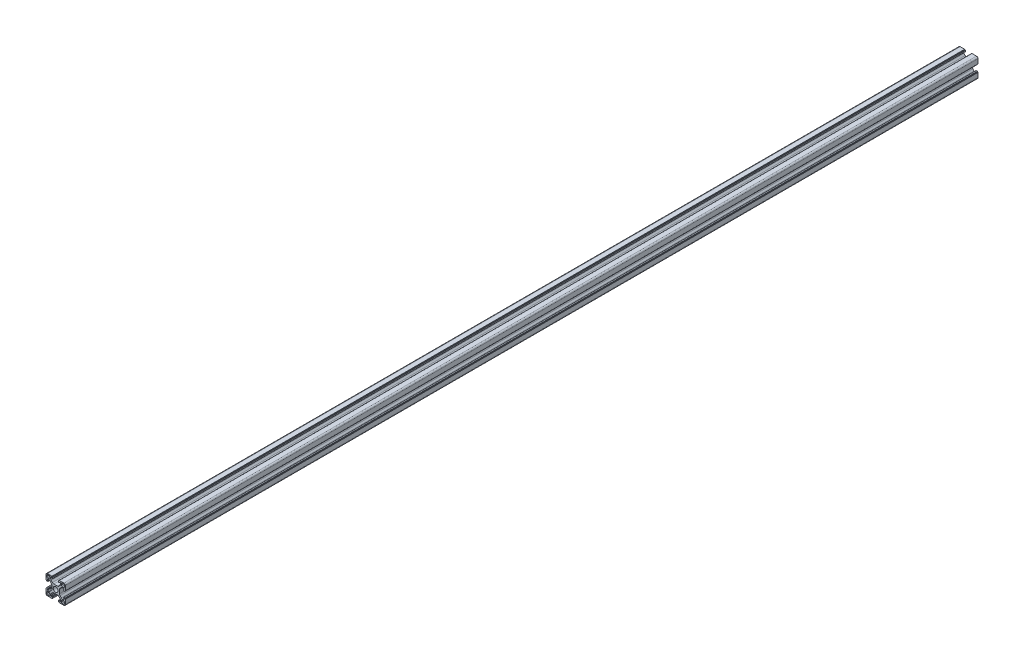
from build123d import *

# Parameters (mm, degrees)
EXTRUDE_1_DEPTH = 945


with BuildPart() as part:
    # Эскиз2 → Бобышка-Вытянуть1 (new body)
    with BuildSketch(Plane.XY):
        with BuildLine():
            Line((0.129852449, 4.683728486), (2.028633118, 4.683728486))
            ThreePointArc((2.028633118, 4.683728486), (2.793999983, 4.835969421), (3.44284668, 5.269514923))
            Line((3.44284668, 5.269514923), (4.744066011, 6.570734254))
            ThreePointArc((4.744066011, 6.570734254), (5.177611514, 7.219580952), (5.329852449, 7.984947817))
            Line((5.329852449, 7.984947817), (5.329852449, 8.883728486))
            ThreePointArc((5.329852449, 8.883728486), (5.183405839, 9.237281876), (4.829852449, 9.383728486))
            Line((4.829852449, 9.383728486), (4.72695923, 9.383728486))
            ThreePointArc((4.72695923, 9.383728486), (4.535617514, 9.345668252), (4.373405839, 9.237281876))
            Line((4.373405839, 9.237281876), (3.893075754, 8.75695179))
            ThreePointArc((3.893075754, 8.75695179), (3.811969916, 8.702758603), (3.716299058, 8.683728486))
            Line((3.716299058, 8.683728486), (3.429852449, 8.683728486))
            ThreePointArc((3.429852449, 8.683728486), (3.253075754, 8.75695179), (3.179852449, 8.933728486))
            Line((3.179852449, 8.933728486), (3.179852449, 10.082799306))
            ThreePointArc((3.179852449, 10.082799306), (3.223786432, 10.188865323), (3.329852449, 10.232799306))
            Line((3.329852449, 10.232799306), (3.829852449, 10.232799306))
            Line((3.829852449, 10.232799306), (3.829852449, 10.533728486))
            ThreePointArc((3.829852449, 10.533728486), (3.873786432, 10.639794503), (3.979852449, 10.683728486))
            Line((3.979852449, 10.683728486), (8.629852449, 10.683728486))
            ThreePointArc((8.629852449, 10.683728486), (9.690512621, 10.244388658), (10.129852449, 9.183728486))
            Line((10.129852449, 9.183728486), (10.129852449, 4.533728486))
            ThreePointArc((10.129852449, 4.533728486), (10.085918466, 4.427662469), (9.979852449, 4.383728486))
            Line((9.979852449, 4.383728486), (9.678923269, 4.383728486))
            Line((9.678923269, 4.383728486), (9.678923269, 3.883728486))
            ThreePointArc((9.678923269, 3.883728486), (9.634989287, 3.777662469), (9.528923269, 3.733728486))
            Line((9.528923269, 3.733728486), (8.379852449, 3.733728486))
            ThreePointArc((8.379852449, 3.733728486), (8.203075754, 3.80695179), (8.129852449, 3.983728486))
            Line((8.129852449, 3.983728486), (8.129852449, 4.270175095))
            ThreePointArc((8.129852449, 4.270175095), (8.148882566, 4.365845953), (8.203075754, 4.44695179))
            Line((8.203075754, 4.44695179), (8.683405839, 4.927281876))
            ThreePointArc((8.683405839, 4.927281876), (8.791792215, 5.089493551), (8.829852449, 5.280835267))
            Line((8.829852449, 5.280835267), (8.829852449, 5.383728486))
            ThreePointArc((8.829852449, 5.383728486), (8.683405839, 5.737281876), (8.329852449, 5.883728486))
            Line((8.329852449, 5.883728486), (7.43107178, 5.883728486))
            ThreePointArc((7.43107178, 5.883728486), (6.665704915, 5.731487551), (6.016858217, 5.297942048))
            Line((6.016858217, 5.297942048), (4.715638886, 3.996722717))
            ThreePointArc((4.715638886, 3.996722717), (4.282093384, 3.34787602), (4.129852449, 2.582509155))
            Line((4.129852449, 2.582509155), (4.129852449, 0.683728486))
            Line((4.129852449, 0.683728486), (4.129852449, -1.215052183))
            ThreePointArc((4.129852449, -1.215052183), (4.282093384, -1.980419048), (4.715638886, -2.629265746))
            Line((4.715638886, -2.629265746), (6.016858217, -3.930485077))
            ThreePointArc((6.016858217, -3.930485077), (6.665704915, -4.364030579), (7.43107178, -4.516271514))
            Line((7.43107178, -4.516271514), (8.329852449, -4.516271514))
            ThreePointArc((8.329852449, -4.516271514), (8.683405839, -4.369824905), (8.829852449, -4.016271514))
            Line((8.829852449, -4.016271514), (8.829852449, -3.913378295))
            ThreePointArc((8.829852449, -3.913378295), (8.791792215, -3.722036579), (8.683405839, -3.559824905))
            Line((8.683405839, -3.559824905), (8.203075754, -3.079494819))
            ThreePointArc((8.203075754, -3.079494819), (8.148882566, -2.998388982), (8.129852449, -2.902718124))
            Line((8.129852449, -2.902718124), (8.129852449, -2.616271514))
            ThreePointArc((8.129852449, -2.616271514), (8.203075754, -2.439494819), (8.379852449, -2.366271514))
            Line((8.379852449, -2.366271514), (9.528923269, -2.366271514))
            ThreePointArc((9.528923269, -2.366271514), (9.634989287, -2.410205497), (9.678923269, -2.516271514))
            Line((9.678923269, -2.516271514), (9.678923269, -3.016271514))
            Line((9.678923269, -3.016271514), (9.979852449, -3.016271514))
            ThreePointArc((9.979852449, -3.016271514), (10.085918466, -3.060205497), (10.129852449, -3.166271514))
            Line((10.129852449, -3.166271514), (10.129852449, -7.816271514))
            ThreePointArc((10.129852449, -7.816271514), (9.690512621, -8.876931686), (8.629852449, -9.316271514))
            Line((8.629852449, -9.316271514), (3.979852449, -9.316271514))
            ThreePointArc((3.979852449, -9.316271514), (3.873786432, -9.272337531), (3.829852449, -9.166271514))
            Line((3.829852449, -9.166271514), (3.829852449, -8.865342335))
            Line((3.829852449, -8.865342335), (3.329852449, -8.865342335))
            ThreePointArc((3.329852449, -8.865342335), (3.223786432, -8.821408352), (3.179852449, -8.715342335))
            Line((3.179852449, -8.715342335), (3.179852449, -7.566271514))
            ThreePointArc((3.179852449, -7.566271514), (3.253075754, -7.389494819), (3.429852449, -7.316271514))
            Line((3.429852449, -7.316271514), (3.716299058, -7.316271514))
            ThreePointArc((3.716299058, -7.316271514), (3.811969916, -7.335301631), (3.893075754, -7.389494819))
            Line((3.893075754, -7.389494819), (4.373405839, -7.869824905))
            ThreePointArc((4.373405839, -7.869824905), (4.535617514, -7.978211281), (4.72695923, -8.016271514))
            Line((4.72695923, -8.016271514), (4.829852449, -8.016271514))
            ThreePointArc((4.829852449, -8.016271514), (5.183405839, -7.869824905), (5.329852449, -7.516271514))
            Line((5.329852449, -7.516271514), (5.329852449, -6.617490845))
            ThreePointArc((5.329852449, -6.617490845), (5.177611514, -5.85212398), (4.744066011, -5.203277283))
            Line((4.744066011, -5.203277283), (3.44284668, -3.902057952))
            ThreePointArc((3.44284668, -3.902057952), (2.793999983, -3.468512449), (2.028633118, -3.316271514))
            Line((2.028633118, -3.316271514), (0.129852449, -3.316271514))
            Line((0.129852449, -3.316271514), (-1.76892822, -3.316271514))
            ThreePointArc((-1.76892822, -3.316271514), (-2.534295085, -3.468512449), (-3.183141783, -3.902057952))
            Line((-3.183141783, -3.902057952), (-4.484361114, -5.203277283))
            ThreePointArc((-4.484361114, -5.203277283), (-4.917906616, -5.85212398), (-5.070147551, -6.617490845))
            Line((-5.070147551, -6.617490845), (-5.070147551, -7.516271514))
            ThreePointArc((-5.070147551, -7.516271514), (-4.923700942, -7.869824905), (-4.570147551, -8.016271514))
            Line((-4.570147551, -8.016271514), (-4.467254332, -8.016271514))
            ThreePointArc((-4.467254332, -8.016271514), (-4.275912616, -7.978211281), (-4.113700942, -7.869824905))
            Line((-4.113700942, -7.869824905), (-3.633370856, -7.389494819))
            ThreePointArc((-3.633370856, -7.389494819), (-3.552265019, -7.335301631), (-3.456594161, -7.316271514))
            Line((-3.456594161, -7.316271514), (-3.170147551, -7.316271514))
            ThreePointArc((-3.170147551, -7.316271514), (-2.993370856, -7.389494819), (-2.920147551, -7.566271514))
            Line((-2.920147551, -7.566271514), (-2.920147551, -8.715342335))
            ThreePointArc((-2.920147551, -8.715342335), (-2.964081534, -8.821408352), (-3.070147551, -8.865342335))
            Line((-3.070147551, -8.865342335), (-3.570147551, -8.865342335))
            Line((-3.570147551, -8.865342335), (-3.570147551, -9.166271514))
            ThreePointArc((-3.570147551, -9.166271514), (-3.614081534, -9.272337531), (-3.720147551, -9.316271514))
            Line((-3.720147551, -9.316271514), (-8.370147551, -9.316271514))
            ThreePointArc((-8.370147551, -9.316271514), (-9.430807723, -8.876931686), (-9.870147551, -7.816271514))
            Line((-9.870147551, -7.816271514), (-9.870147551, -3.166271514))
            ThreePointArc((-9.870147551, -3.166271514), (-9.826213568, -3.060205497), (-9.720147551, -3.016271514))
            Line((-9.720147551, -3.016271514), (-9.419218372, -3.016271514))
            Line((-9.419218372, -3.016271514), (-9.419218372, -2.516271514))
            ThreePointArc((-9.419218372, -2.516271514), (-9.375284389, -2.410205497), (-9.269218372, -2.366271514))
            Line((-9.269218372, -2.366271514), (-8.120147551, -2.366271514))
            ThreePointArc((-8.120147551, -2.366271514), (-7.943370856, -2.439494819), (-7.870147551, -2.616271514))
            Line((-7.870147551, -2.616271514), (-7.870147551, -2.902718124))
            ThreePointArc((-7.870147551, -2.902718124), (-7.889177668, -2.998388982), (-7.943370856, -3.079494819))
            Line((-7.943370856, -3.079494819), (-8.423700942, -3.559824905))
            ThreePointArc((-8.423700942, -3.559824905), (-8.532087317, -3.722036579), (-8.570147551, -3.913378295))
            Line((-8.570147551, -3.913378295), (-8.570147551, -4.016271514))
            ThreePointArc((-8.570147551, -4.016271514), (-8.423700942, -4.369824905), (-8.070147551, -4.516271514))
            Line((-8.070147551, -4.516271514), (-7.171366882, -4.516271514))
            ThreePointArc((-7.171366882, -4.516271514), (-6.406000017, -4.364030579), (-5.75715332, -3.930485077))
            Line((-5.75715332, -3.930485077), (-4.455933989, -2.629265746))
            ThreePointArc((-4.455933989, -2.629265746), (-4.022388486, -1.980419048), (-3.870147551, -1.215052183))
            Line((-3.870147551, -1.215052183), (-3.870147551, 0.683728486))
            Line((-3.870147551, 0.683728486), (-3.870147551, 2.582509155))
            ThreePointArc((-3.870147551, 2.582509155), (-4.022388486, 3.34787602), (-4.455933989, 3.996722717))
            Line((-4.455933989, 3.996722717), (-5.75715332, 5.297942048))
            ThreePointArc((-5.75715332, 5.297942048), (-6.406000017, 5.731487551), (-7.171366882, 5.883728486))
            Line((-7.171366882, 5.883728486), (-8.070147551, 5.883728486))
            ThreePointArc((-8.070147551, 5.883728486), (-8.423700942, 5.737281876), (-8.570147551, 5.383728486))
            Line((-8.570147551, 5.383728486), (-8.570147551, 5.280835267))
            ThreePointArc((-8.570147551, 5.280835267), (-8.532087317, 5.089493551), (-8.423700942, 4.927281876))
            Line((-8.423700942, 4.927281876), (-7.943370856, 4.44695179))
            ThreePointArc((-7.943370856, 4.44695179), (-7.889177668, 4.365845953), (-7.870147551, 4.270175095))
            Line((-7.870147551, 4.270175095), (-7.870147551, 3.983728486))
            ThreePointArc((-7.870147551, 3.983728486), (-7.943370856, 3.80695179), (-8.120147551, 3.733728486))
            Line((-8.120147551, 3.733728486), (-9.269218372, 3.733728486))
            ThreePointArc((-9.269218372, 3.733728486), (-9.375284389, 3.777662469), (-9.419218372, 3.883728486))
            Line((-9.419218372, 3.883728486), (-9.419218372, 4.383728486))
            Line((-9.419218372, 4.383728486), (-9.720147551, 4.383728486))
            ThreePointArc((-9.720147551, 4.383728486), (-9.826213568, 4.427662469), (-9.870147551, 4.533728486))
            Line((-9.870147551, 4.533728486), (-9.870147551, 9.183728486))
            ThreePointArc((-9.870147551, 9.183728486), (-9.430807723, 10.244388658), (-8.370147551, 10.683728486))
            Line((-8.370147551, 10.683728486), (-3.720147551, 10.683728486))
            ThreePointArc((-3.720147551, 10.683728486), (-3.614081534, 10.639794503), (-3.570147551, 10.533728486))
            Line((-3.570147551, 10.533728486), (-3.570147551, 10.232799306))
            Line((-3.570147551, 10.232799306), (-3.070147551, 10.232799306))
            ThreePointArc((-3.070147551, 10.232799306), (-2.964081534, 10.188865323), (-2.920147551, 10.082799306))
            Line((-2.920147551, 10.082799306), (-2.920147551, 8.933728486))
            ThreePointArc((-2.920147551, 8.933728486), (-2.993370856, 8.75695179), (-3.170147551, 8.683728486))
            Line((-3.170147551, 8.683728486), (-3.456594161, 8.683728486))
            ThreePointArc((-3.456594161, 8.683728486), (-3.552265019, 8.702758603), (-3.633370856, 8.75695179))
            Line((-3.633370856, 8.75695179), (-4.113700942, 9.237281876))
            ThreePointArc((-4.113700942, 9.237281876), (-4.275912616, 9.345668252), (-4.467254332, 9.383728486))
            Line((-4.467254332, 9.383728486), (-4.570147551, 9.383728486))
            ThreePointArc((-4.570147551, 9.383728486), (-4.923700942, 9.237281876), (-5.070147551, 8.883728486))
            Line((-5.070147551, 8.883728486), (-5.070147551, 7.984947817))
            ThreePointArc((-5.070147551, 7.984947817), (-4.917906616, 7.219580952), (-4.484361114, 6.570734254))
            Line((-4.484361114, 6.570734254), (-3.183141783, 5.269514923))
            ThreePointArc((-3.183141783, 5.269514923), (-2.534295085, 4.835969421), (-1.76892822, 4.683728486))
            Line((-1.76892822, 4.683728486), (0.129852449, 4.683728486))
        make_face()
        with BuildLine():
            Line((7.029852449, 6.783728486), (8.429852449, 6.783728486))
            ThreePointArc((8.429852449, 6.783728486), (8.995537874, 7.018043061), (9.229852449, 7.583728486))
            Line((9.229852449, 7.583728486), (9.229852449, 8.983728486))
            ThreePointArc((9.229852449, 8.983728486), (8.995537874, 9.549413911), (8.429852449, 9.783728486))
            Line((8.429852449, 9.783728486), (7.029852449, 9.783728486))
            ThreePointArc((7.029852449, 9.783728486), (6.464167024, 9.549413911), (6.229852449, 8.983728486))
            Line((6.229852449, 8.983728486), (6.229852449, 7.583728486))
            ThreePointArc((6.229852449, 7.583728486), (6.464167024, 7.018043061), (7.029852449, 6.783728486))
        make_face(mode=Mode.SUBTRACT)
        with BuildLine():
            Line((6.229852449, -6.216271514), (6.229852449, -7.616271514))
            ThreePointArc((6.229852449, -7.616271514), (6.464167024, -8.181956939), (7.029852449, -8.416271514))
            Line((7.029852449, -8.416271514), (8.429852449, -8.416271514))
            ThreePointArc((8.429852449, -8.416271514), (8.995537874, -8.181956939), (9.229852449, -7.616271514))
            Line((9.229852449, -7.616271514), (9.229852449, -6.216271514))
            ThreePointArc((9.229852449, -6.216271514), (8.995537874, -5.650586089), (8.429852449, -5.416271514))
            Line((8.429852449, -5.416271514), (7.029852449, -5.416271514))
            ThreePointArc((7.029852449, -5.416271514), (6.464167024, -5.650586089), (6.229852449, -6.216271514))
        make_face(mode=Mode.SUBTRACT)
        with BuildLine():
            Line((-6.770147551, -5.416271514), (-8.170147551, -5.416271514))
            ThreePointArc((-8.170147551, -5.416271514), (-8.735832976, -5.650586089), (-8.970147551, -6.216271514))
            Line((-8.970147551, -6.216271514), (-8.970147551, -7.616271514))
            ThreePointArc((-8.970147551, -7.616271514), (-8.735832976, -8.181956939), (-8.170147551, -8.416271514))
            Line((-8.170147551, -8.416271514), (-6.770147551, -8.416271514))
            ThreePointArc((-6.770147551, -8.416271514), (-6.204462126, -8.181956939), (-5.970147551, -7.616271514))
            Line((-5.970147551, -7.616271514), (-5.970147551, -6.216271514))
            ThreePointArc((-5.970147551, -6.216271514), (-6.204462126, -5.650586089), (-6.770147551, -5.416271514))
        make_face(mode=Mode.SUBTRACT)
        with BuildLine():
            Line((-5.970147551, 7.583728486), (-5.970147551, 8.983728486))
            ThreePointArc((-5.970147551, 8.983728486), (-6.204462126, 9.549413911), (-6.770147551, 9.783728486))
            Line((-6.770147551, 9.783728486), (-8.170147551, 9.783728486))
            ThreePointArc((-8.170147551, 9.783728486), (-8.735832976, 9.549413911), (-8.970147551, 8.983728486))
            Line((-8.970147551, 8.983728486), (-8.970147551, 7.583728486))
            ThreePointArc((-8.970147551, 7.583728486), (-8.735832976, 7.018043061), (-8.170147551, 6.783728486))
            Line((-8.170147551, 6.783728486), (-6.770147551, 6.783728486))
            ThreePointArc((-6.770147551, 6.783728486), (-6.204462126, 7.018043061), (-5.970147551, 7.583728486))
        make_face(mode=Mode.SUBTRACT)
        with BuildLine():
            ThreePointArc((2.629852449, 0.683728486), (1.897619402, 2.451495439), (0.129852449, 3.183728486))
            ThreePointArc((0.129852449, 3.183728486), (-1.637914504, 2.451495439), (-2.370147551, 0.683728486))
            ThreePointArc((-2.370147551, 0.683728486), (-1.637914504, -1.084038467), (0.129852449, -1.816271514))
            ThreePointArc((0.129852449, -1.816271514), (1.897619402, -1.084038467), (2.629852449, 0.683728486))
        make_face(mode=Mode.SUBTRACT)
    extrude(amount=EXTRUDE_1_DEPTH)


solid = part.part
